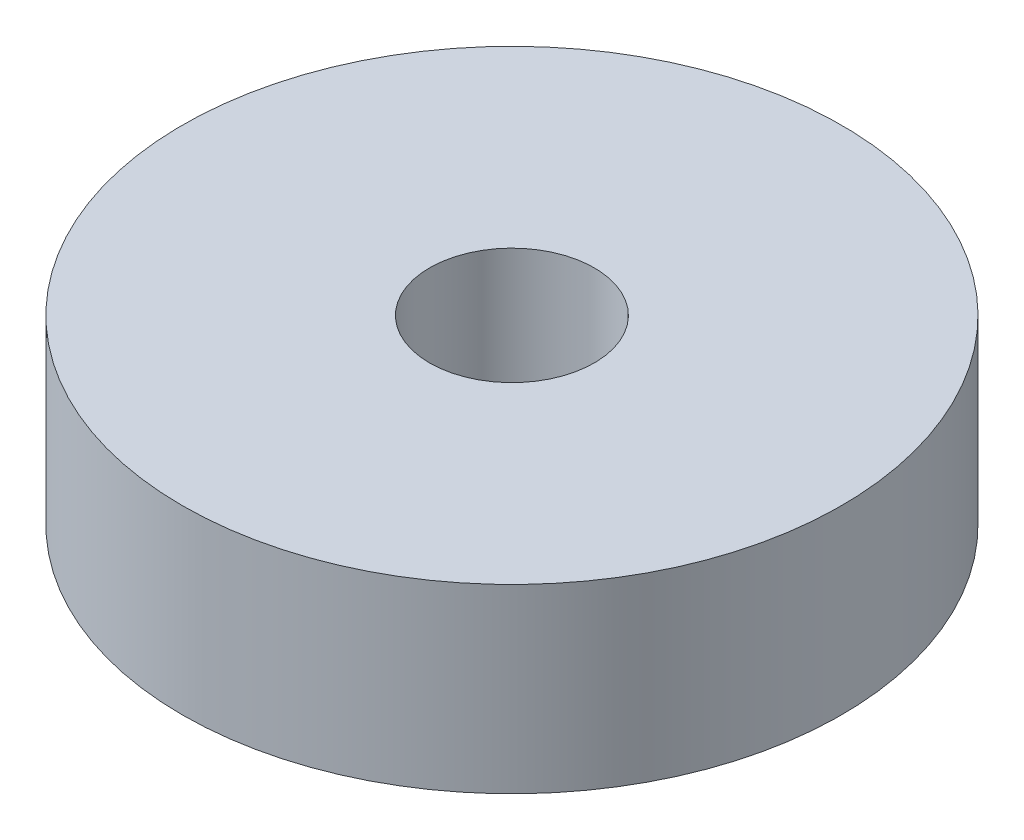
from build123d import *

# Parameters (mm, degrees)
SKETCH1_R           = 25.4
SKETCH1_R_2         = 6.35
BOSS_EXTRUDE1_DEPTH = 13.97


with BuildPart() as part:
    # Sketch1 → Boss-Extrude1 (new body)
    with BuildSketch(Plane(origin=(0, 0, 0), x_dir=(1, 0, 0), z_dir=(0, 1, 0))):
        with Locations(Location((0, 0, 0), (0, 0, 270))):
            Circle(SKETCH1_R)
        with Locations(Location((0, 0, 0), (0, 0, 270))):
            Circle(SKETCH1_R_2, mode=Mode.SUBTRACT)
    extrude(amount=BOSS_EXTRUDE1_DEPTH)


solid = part.part
